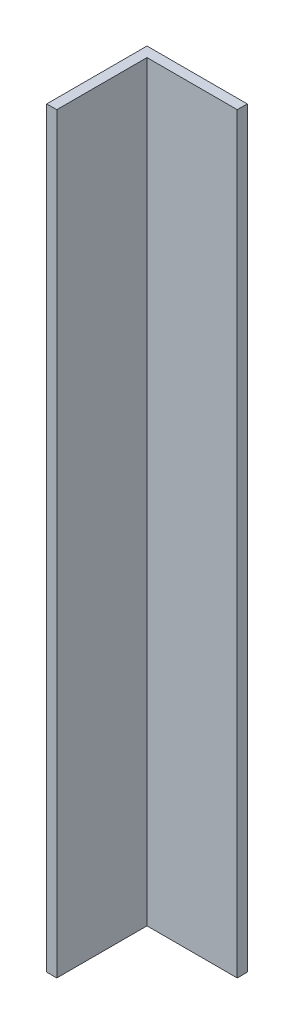
from build123d import *

# Parameters (mm, degrees)
BOSS_EXTRUDE1_DEPTH = 150


with BuildPart() as part:
    # Sketch1 → Boss-Extrude1 (new body)
    with BuildSketch(Plane(origin=(0, 0, 0), x_dir=(1, 0, 0), z_dir=(0, 1, 0))):
        Polygon((-4.67162592, 238.015372113), (-24.67162592, 238.015372113), (-24.67162592, 218.015372113), (-22.67162592, 218.015372113), (-22.67162592, 236.015372113), (-4.67162592, 236.015372113), align=None)
    extrude(amount=BOSS_EXTRUDE1_DEPTH)


solid = part.part
